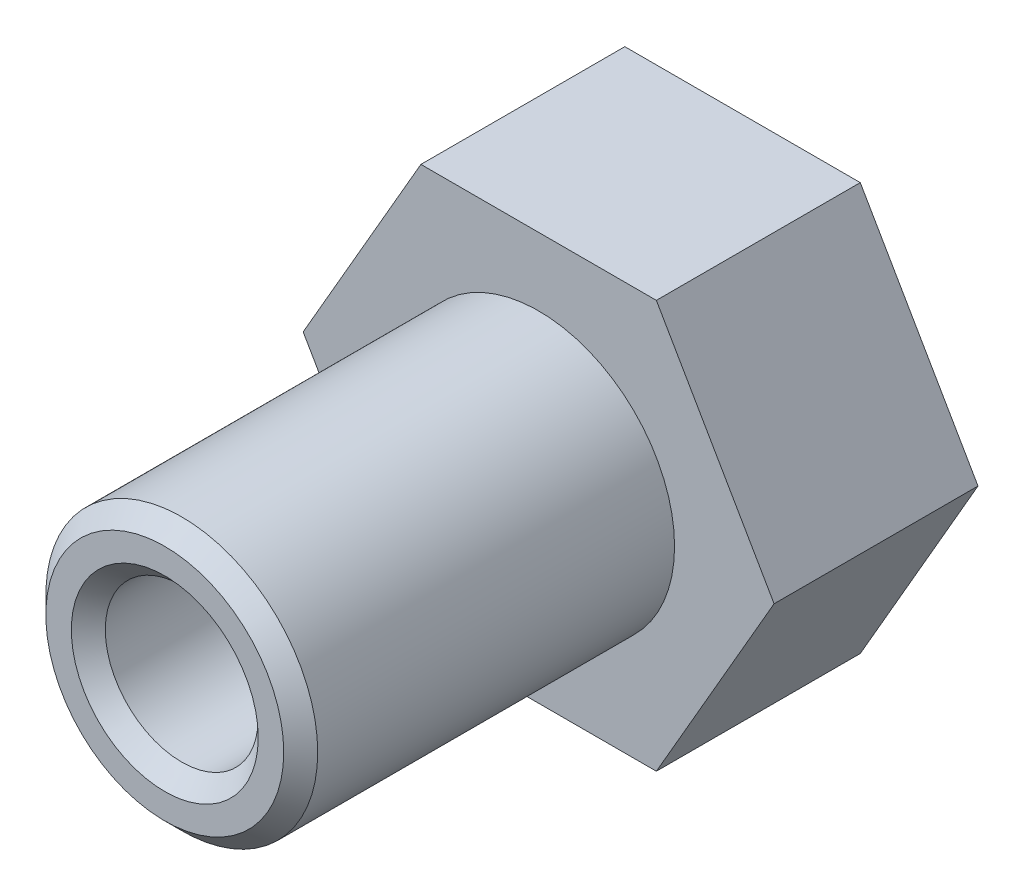
from build123d import *

# Parameters (mm, degrees)
EXTRUDE_1_DEPTH     = 12
SKETCH_2_R          = 8
EXTRUDE_2_DEPTH     = 22
SKETCH_3_R          = 4.5
CUT_EXTRUDE_3_DEPTH = 39.626415832
CHAMFER_1_SIZE      = 1
CHAMFER_2_SIZE      = 1


with BuildPart() as part:
    # 草图1 → 拉伸1 (new body)
    with BuildSketch(Plane.XY):
        Polygon((-6.92820323, -12), (6.92820323, -12), (13.856406461, 0), (6.92820323, 12), (-6.92820323, 12), (-13.856406461, 0), align=None)
    extrude(amount=EXTRUDE_1_DEPTH)

    # 草图2 → 拉伸2 (add)
    with BuildSketch(Plane.XY.offset(12)):
        Circle(SKETCH_2_R)
    extrude(amount=EXTRUDE_2_DEPTH)

    # 草图3 → 拉伸3 (cut, through all)
    with BuildSketch(Plane(origin=(0, 0, 0), x_dir=(-1, 0, 0), z_dir=(0, 0, -1))):
        Circle(SKETCH_3_R)
    extrude(amount=-CUT_EXTRUDE_3_DEPTH, mode=Mode.SUBTRACT)

    # 倒角1
    chamfer_1_edges = [part.edges().sort_by_distance(p)[0] for p in [
        (-8, 0, 34),
    ]]
    chamfer(chamfer_1_edges, length=CHAMFER_1_SIZE)

    # 倒角2
    chamfer_2_edges = [part.edges().sort_by_distance(p)[0] for p in [
        (4.5, 0, 34),
    ]]
    chamfer(chamfer_2_edges, length=CHAMFER_2_SIZE)


solid = part.part
